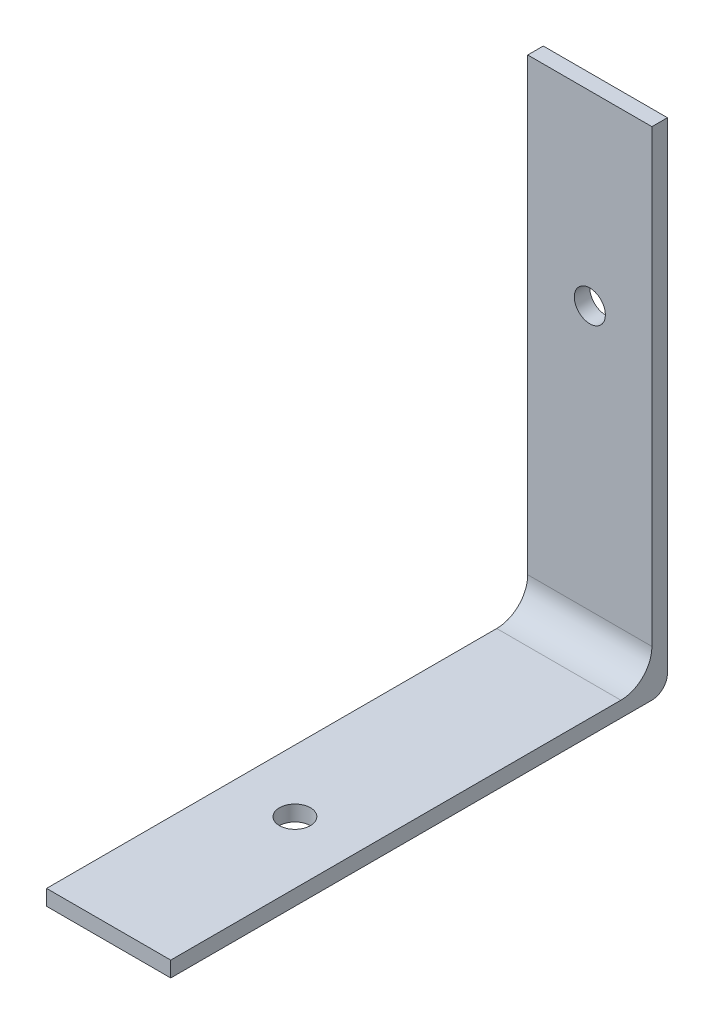
from build123d import *

# Parameters (mm, degrees)
BOSS_EXTRUDE1_DEPTH = 12.7
SKETCH2_R           = 1.5875
CUT_EXTRUDE1_DEPTH  = 17.526
SKETCH3_R           = 1.5875
CUT_EXTRUDE2_DEPTH  = 17.526


with BuildPart() as part:
    # Sketch1 → Boss-Extrude1 (new body)
    with BuildSketch(Plane(origin=(0, 0, 0), x_dir=(0, 0, -1), z_dir=(1, 0, 0))):
        with BuildLine():
            Line((0, 0), (49.2125, 0))
            ThreePointArc((49.2125, 0), (50.335032015, 0.464967985), (50.8, 1.5875))
            Line((50.8, 1.5875), (50.8, 50.8))
            Line((50.8, 50.8), (49.2125, 50.8))
            Line((49.2125, 50.8), (49.2125, 4.7625))
            ThreePointArc((49.2125, 4.7625), (48.28256403, 2.51743597), (46.0375, 1.5875))
            Line((46.0375, 1.5875), (0, 1.5875))
            Line((0, 1.5875), (0, 0))
        make_face()
    extrude(amount=BOSS_EXTRUDE1_DEPTH)

    # Sketch2 → Cut-Extrude1 (cut)
    with BuildSketch(Plane.XY.offset(-49.2125)):
        with Locations((6.35, 31.75)):
            Circle(SKETCH2_R)
    extrude(amount=-CUT_EXTRUDE1_DEPTH, mode=Mode.SUBTRACT)

    # Sketch3 → Cut-Extrude2 (cut)
    with BuildSketch(Plane(origin=(0, 1.5875, 0), x_dir=(1, 0, 0), z_dir=(0, 1, 0))):
        with Locations(Location((6.35, 19.05, 0), (0, 0, 270))):
            Circle(SKETCH3_R)
    extrude(amount=-CUT_EXTRUDE2_DEPTH, mode=Mode.SUBTRACT)


solid = part.part
